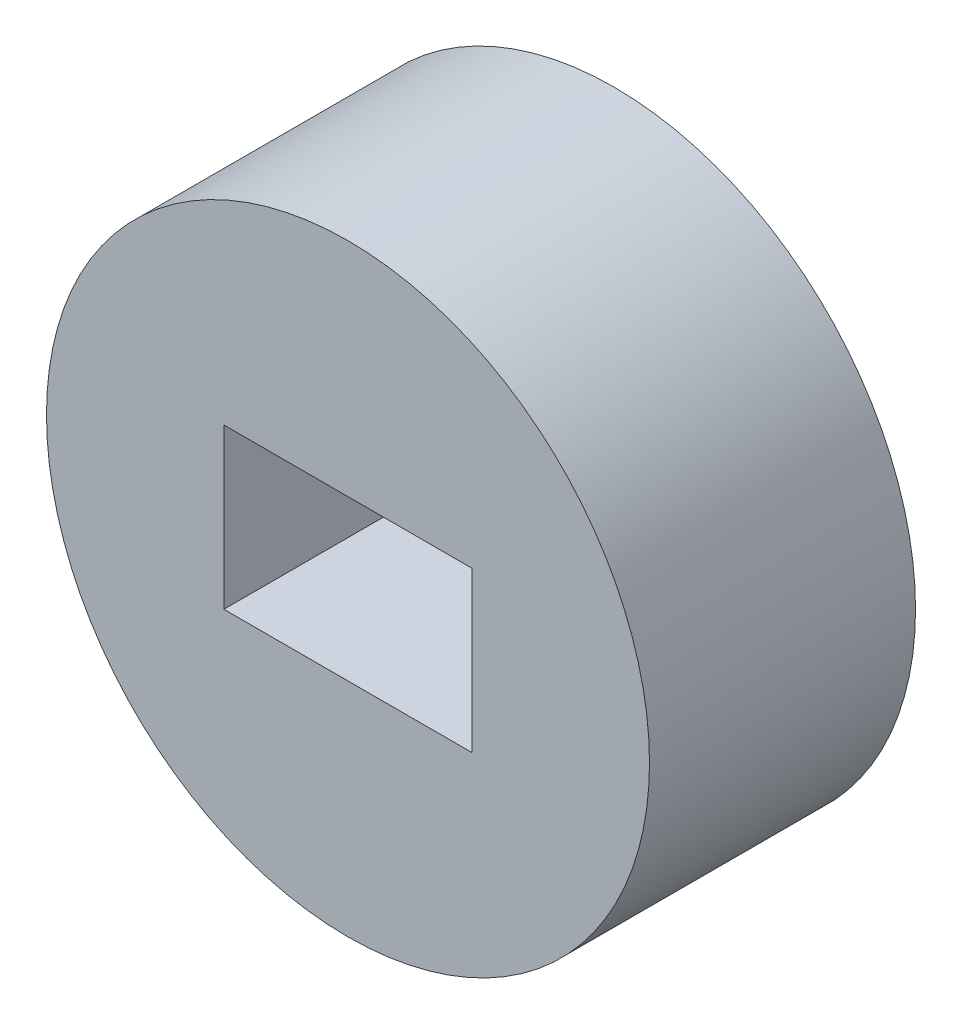
from build123d import *

# Parameters (mm, degrees)
MODEL_R                 = 3.4
MODEL_W                 = 2.8
MODEL_H                 = 1.8
SALIENTE_EXTRUIR1_DEPTH = 3


with BuildPart() as part:
    # Model → Saliente-Extruir1 (new body)
    with BuildSketch(Plane.XY):
        with Locations((12.869725503, 293.551469222)):
            Circle(MODEL_R)
        with Locations((12.869725503, 293.551469222)):
            Rectangle(MODEL_W, MODEL_H, mode=Mode.SUBTRACT)
    extrude(amount=SALIENTE_EXTRUIR1_DEPTH)


solid = part.part
